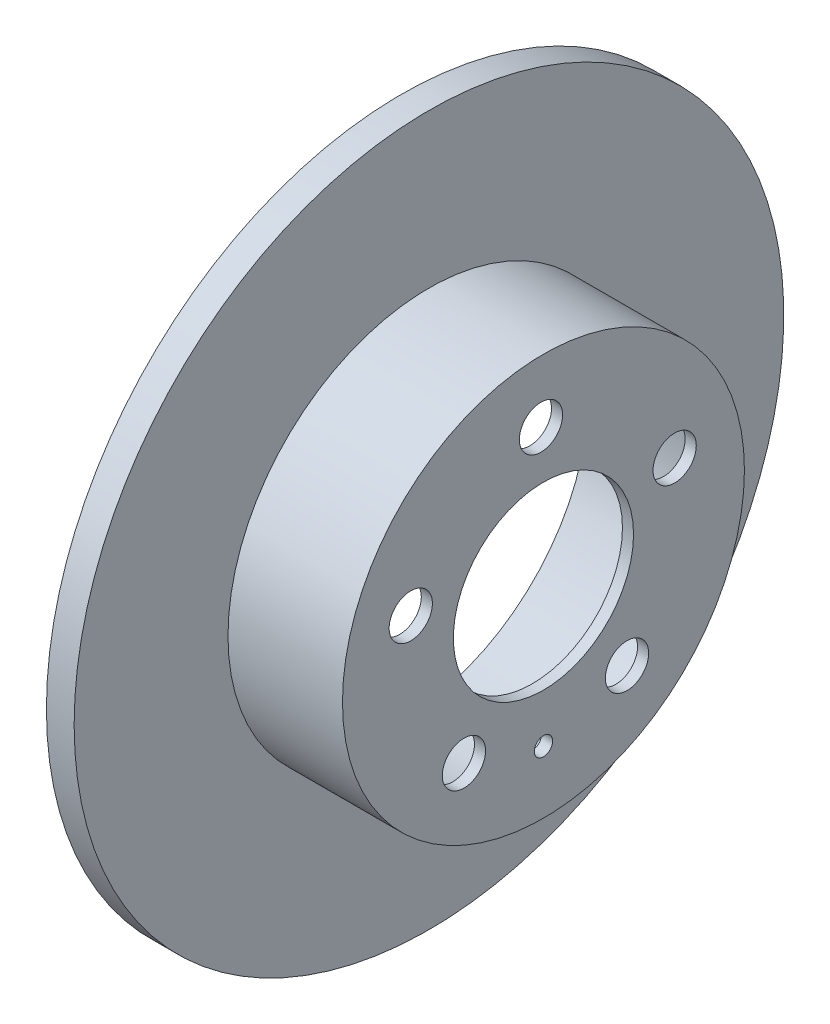
from build123d import *

# Parameters (mm, degrees)
SZKIC1_W                    = 10
SZKIC1_H                    = 128
SZKIC7_R                    = 72.5
DODANIE_WYCI_GNI_CIE1_DEPTH = 41.3
SZKIC8_R                    = 67.5
WYTNIJ_WYCI_GNI_CIE7_DEPTH  = 47.3
WYTNIJ_WYCI_GNI_CIE8_REACH  = 190.148
SZKIC9_R                    = 32.5
WYTNIJ_WYCI_GNI_CIE9_REACH  = 190.148
SZKIC10_R                   = 3.3
SZKIC10_R_2                 = 7.8


with BuildPart() as part:
    # Szkic1 → Obrót1 (revolve)
    with BuildSketch(Plane(origin=(0, 0, 0), x_dir=(1, 0, 0), z_dir=(0, 1, 0)), mode=Mode.PRIVATE) as obr_t1_sk:
        with Locations((5, 64)):
            Rectangle(SZKIC1_W, SZKIC1_H)
    revolve(obr_t1_sk.sketch.rotate(Axis((0, 0, 0), (1, 0, 0)), 180), axis=Axis((0, 0, 0), (1, 0, 0)))

    # Szkic7 → Dodanie-wyciągnięcie1 (add)
    with BuildSketch(Plane(origin=(10, 0, 0), x_dir=(0, 0, -1), z_dir=(1, 0, 0))):
        with Locations(Location((0, 0, 0), (0, 0, 180))):
            Circle(SZKIC7_R)
    extrude(amount=DODANIE_WYCI_GNI_CIE1_DEPTH)

    # Szkic8 → Wytnij-wyciągnięcie7 (cut)
    with BuildSketch(Plane.ZY):
        Circle(SZKIC8_R)
    extrude(amount=-WYTNIJ_WYCI_GNI_CIE7_DEPTH, mode=Mode.SUBTRACT)

    # Szkic9 → Wytnij-wyciągnięcie8 (cut, up to next)
    with BuildSketch(Plane(origin=(51.3, 0, 0), x_dir=(0, 0, -1), z_dir=(1, 0, 0)), mode=Mode.PRIVATE) as wytnij_wyci_gni_cie8_sk1:
        Circle(SZKIC9_R)
    wytnij_wyci_gni_cie8_tool1 = extrude(wytnij_wyci_gni_cie8_sk1.sketch, amount=-WYTNIJ_WYCI_GNI_CIE8_REACH, mode=Mode.PRIVATE) & part.part
    add(wytnij_wyci_gni_cie8_tool1.solids().sort_by_distance((51.3, 0, 0))[0], mode=Mode.SUBTRACT)

    # Szkic10 → Wytnij-wyciągnięcie9 (cut, up to next)
    with BuildSketch(Plane(origin=(51.3, 0, 0), x_dir=(0, 0, -1), z_dir=(1, 0, 0)), mode=Mode.PRIVATE) as wytnij_wyci_gni_cie9_sk1:
        with Locations((0, -50)):
            Circle(SZKIC10_R)
    wytnij_wyci_gni_cie9_tool1 = extrude(wytnij_wyci_gni_cie9_sk1.sketch, amount=-WYTNIJ_WYCI_GNI_CIE9_REACH, mode=Mode.PRIVATE) & part.part
    # Szkic10 → Wytnij-wyciągnięcie9 (cut, up to next)
    with BuildSketch(Plane(origin=(51.3, 0, 0), x_dir=(0, 0, -1), z_dir=(1, 0, 0)), mode=Mode.PRIVATE) as wytnij_wyci_gni_cie9_sk2:
        with Locations((-28.682618124, -40.95494375)):
            Circle(SZKIC10_R_2)
    wytnij_wyci_gni_cie9_tool2 = extrude(wytnij_wyci_gni_cie9_sk2.sketch, amount=-WYTNIJ_WYCI_GNI_CIE9_REACH, mode=Mode.PRIVATE) & part.part
    # Szkic10 → Wytnij-wyciągnięcie9 (cut, up to next)
    with BuildSketch(Plane(origin=(51.3, 0, 0), x_dir=(0, 0, -1), z_dir=(1, 0, 0)), mode=Mode.PRIVATE) as wytnij_wyci_gni_cie9_sk3:
        with Locations((-47.865538925, 14.672227833)):
            Circle(SZKIC10_R_2)
    wytnij_wyci_gni_cie9_tool3 = extrude(wytnij_wyci_gni_cie9_sk3.sketch, amount=-WYTNIJ_WYCI_GNI_CIE9_REACH, mode=Mode.PRIVATE) & part.part
    # Szkic10 → Wytnij-wyciągnięcie9 (cut, up to next)
    with BuildSketch(Plane(origin=(51.3, 0, 0), x_dir=(0, 0, -1), z_dir=(1, 0, 0)), mode=Mode.PRIVATE) as wytnij_wyci_gni_cie9_sk4:
        with Locations((-0.888803437, 50.106011031)):
            Circle(SZKIC10_R_2)
    wytnij_wyci_gni_cie9_tool4 = extrude(wytnij_wyci_gni_cie9_sk4.sketch, amount=-WYTNIJ_WYCI_GNI_CIE9_REACH, mode=Mode.PRIVATE) & part.part
    # Szkic10 → Wytnij-wyciągnięcie9 (cut, up to next)
    with BuildSketch(Plane(origin=(51.3, 0, 0), x_dir=(0, 0, -1), z_dir=(1, 0, 0)), mode=Mode.PRIVATE) as wytnij_wyci_gni_cie9_sk5:
        with Locations((47.327336576, 16.378121814)):
            Circle(SZKIC10_R_2)
    wytnij_wyci_gni_cie9_tool5 = extrude(wytnij_wyci_gni_cie9_sk5.sketch, amount=-WYTNIJ_WYCI_GNI_CIE9_REACH, mode=Mode.PRIVATE) & part.part
    # Szkic10 → Wytnij-wyciągnięcie9 (cut, up to next)
    with BuildSketch(Plane(origin=(51.3, 0, 0), x_dir=(0, 0, -1), z_dir=(1, 0, 0)), mode=Mode.PRIVATE) as wytnij_wyci_gni_cie9_sk6:
        with Locations((30.149814423, -39.900643288)):
            Circle(SZKIC10_R_2)
    wytnij_wyci_gni_cie9_tool6 = extrude(wytnij_wyci_gni_cie9_sk6.sketch, amount=-WYTNIJ_WYCI_GNI_CIE9_REACH, mode=Mode.PRIVATE) & part.part
    add(wytnij_wyci_gni_cie9_tool1.solids().sort_by_distance((51.3, -50, 0))[0], mode=Mode.SUBTRACT)
    add(wytnij_wyci_gni_cie9_tool2.solids().sort_by_distance((51.3, -40.954944, 28.682618))[0], mode=Mode.SUBTRACT)
    add(wytnij_wyci_gni_cie9_tool3.solids().sort_by_distance((51.3, 14.672228, 47.865539))[0], mode=Mode.SUBTRACT)
    add(wytnij_wyci_gni_cie9_tool4.solids().sort_by_distance((51.3, 50.106011, 0.888803))[0], mode=Mode.SUBTRACT)
    add(wytnij_wyci_gni_cie9_tool5.solids().sort_by_distance((51.3, 16.378122, -47.327337))[0], mode=Mode.SUBTRACT)
    add(wytnij_wyci_gni_cie9_tool6.solids().sort_by_distance((51.3, -39.900643, -30.149814))[0], mode=Mode.SUBTRACT)


solid = part.part
